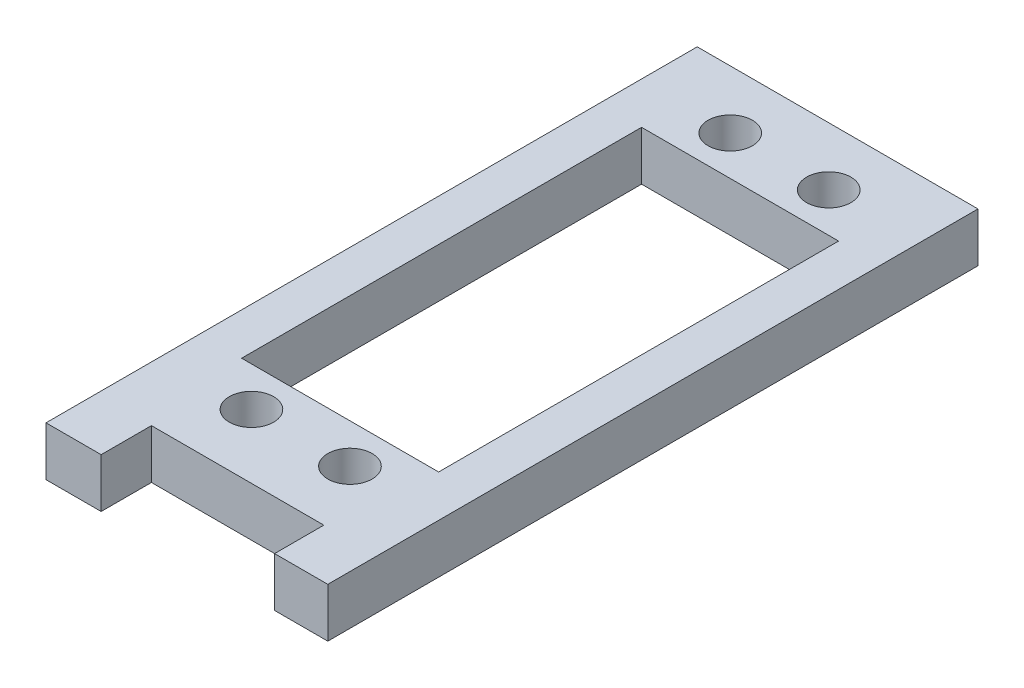
from build123d import *

# Parameters (mm, degrees)
SKETCH1_R           = 2.25
SKETCH1_W           = 20
SKETCH1_H           = 40.6
BOSS_EXTRUDE1_DEPTH = 5


with BuildPart() as part:
    # Sketch1 → Boss-Extrude1 (new body)
    with BuildSketch(Plane(origin=(0, 0, 0), x_dir=(1, 0, 0), z_dir=(0, 1, 0))):
        Polygon((-4.25, -48), (-4.25, 7.4), (-4.25, 9.9), (24.25, 9.9), (24.25, 7.4), (24.25, -48), (24.25, -56.1), (18.848117926, -56.1), (18.848117926, -51.1), (1.348117926, -51.1), (1.348117926, -56.204802146), (-4.25, -56.204802146), align=None)
        with Locations(Location((5, 4, 0), (0, 0, 270))):
            Circle(SKETCH1_R, mode=Mode.SUBTRACT)
        with Locations(Location((15, 4, 0), (0, 0, 90))):
            Circle(SKETCH1_R, mode=Mode.SUBTRACT)
        with Locations(Location((5, -44.6, 0), (0, 0, 90))):
            Circle(SKETCH1_R, mode=Mode.SUBTRACT)
        with Locations(Location((15, -44.6, 0), (0, 0, 270))):
            Circle(SKETCH1_R, mode=Mode.SUBTRACT)
        with Locations((10, -20.3)):
            Rectangle(SKETCH1_W, SKETCH1_H, mode=Mode.SUBTRACT)
    extrude(amount=BOSS_EXTRUDE1_DEPTH)


solid = part.part
